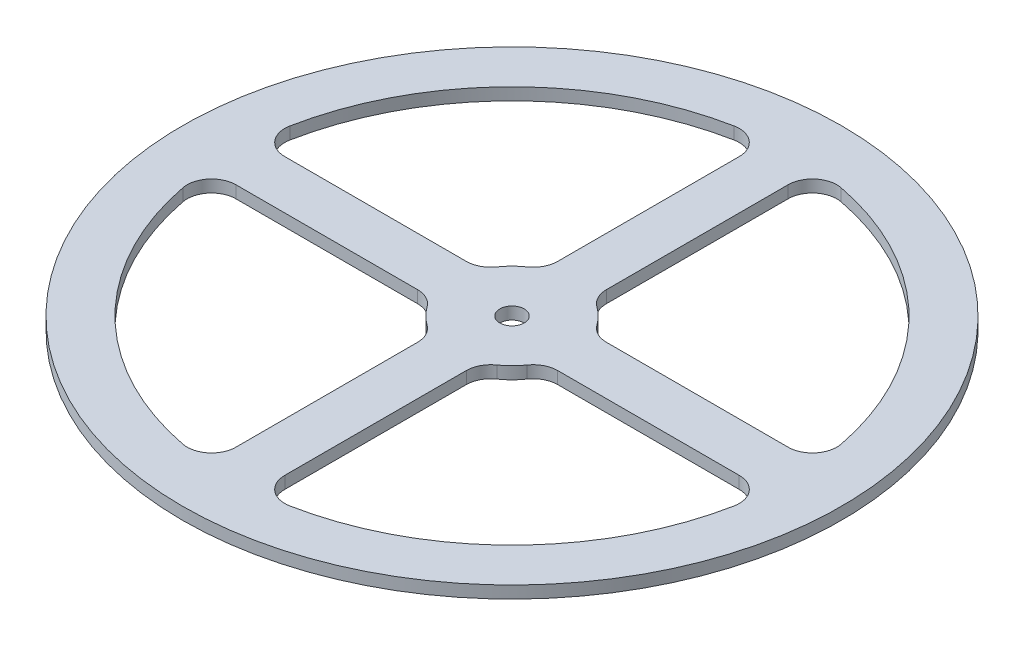
from build123d import *

# Parameters (mm, degrees)
SKETCH_1_R      = 135
SKETCH_1_R_2    = 5
EXTRUDE_1_DEPTH = 5


with BuildPart() as part:
    # ｽｹｯﾁ1 → ﾎﾞｽ - 押し出し1 (new body)
    with BuildSketch(Plane(origin=(0, 0, 0), x_dir=(1, 0, 0), z_dir=(0, 1, 0))):
        with Locations(Location((0, 0, 0), (0, 0, 270))):
            Circle(SKETCH_1_R)
        with Locations(Location((0, 0, 0), (0, 0, 270))):
            Circle(SKETCH_1_R_2, mode=Mode.SUBTRACT)
        with BuildLine():
            Line((-103.07764064, 10), (-28.722813233, 10))
            ThreePointArc((-28.722813233, 10), (-24.093712734, 11.135947396), (-20.516295166, 14.285714286))
            ThreePointArc((-20.516295166, 14.285714286), (-17.67766953, 17.67766953), (-14.285714286, 20.516295166))
            ThreePointArc((-14.285714286, 20.516295166), (-11.135947396, 24.093712734), (-10, 28.722813233))
            Line((-10, 28.722813233), (-10, 103.07764064))
            ThreePointArc((-10, 103.07764064), (-13.637909897, 110.792808139), (-21.904761905, 112.894558797))
            ThreePointArc((-21.904761905, 112.894558797), (-81.317279836, 81.317279836), (-112.894558797, 21.904761905))
            ThreePointArc((-112.894558797, 21.904761905), (-110.792808139, 13.637909897), (-103.07764064, 10))
        make_face(mode=Mode.SUBTRACT)
        with BuildLine():
            Line((10, 103.07764064), (10, 28.722813233))
            ThreePointArc((10, 28.722813233), (11.135947396, 24.093712734), (14.285714286, 20.516295166))
            ThreePointArc((14.285714286, 20.516295166), (17.67766953, 17.67766953), (20.516295166, 14.285714286))
            ThreePointArc((20.516295166, 14.285714286), (24.093712734, 11.135947396), (28.722813233, 10))
            Line((28.722813233, 10), (103.07764064, 10))
            ThreePointArc((103.07764064, 10), (110.792808139, 13.637909897), (112.894558797, 21.904761905))
            ThreePointArc((112.894558797, 21.904761905), (81.317279836, 81.317279836), (21.904761905, 112.894558797))
            ThreePointArc((21.904761905, 112.894558797), (13.637909897, 110.792808139), (10, 103.07764064))
        make_face(mode=Mode.SUBTRACT)
        with BuildLine():
            Line((103.07764064, -10), (28.722813233, -10))
            ThreePointArc((28.722813233, -10), (24.093712734, -11.135947396), (20.516295166, -14.285714286))
            ThreePointArc((20.516295166, -14.285714286), (17.67766953, -17.67766953), (14.285714286, -20.516295166))
            ThreePointArc((14.285714286, -20.516295166), (11.135947396, -24.093712734), (10, -28.722813233))
            Line((10, -28.722813233), (10, -103.07764064))
            ThreePointArc((10, -103.07764064), (13.637909897, -110.792808139), (21.904761905, -112.894558797))
            ThreePointArc((21.904761905, -112.894558797), (81.317279836, -81.317279836), (112.894558797, -21.904761905))
            ThreePointArc((112.894558797, -21.904761905), (110.792808139, -13.637909897), (103.07764064, -10))
        make_face(mode=Mode.SUBTRACT)
        with BuildLine():
            Line((-10, -103.07764064), (-10, -28.722813233))
            ThreePointArc((-10, -28.722813233), (-11.135947396, -24.093712734), (-14.285714286, -20.516295166))
            ThreePointArc((-14.285714286, -20.516295166), (-17.67766953, -17.67766953), (-20.516295166, -14.285714286))
            ThreePointArc((-20.516295166, -14.285714286), (-24.093712734, -11.135947396), (-28.722813233, -10))
            Line((-28.722813233, -10), (-103.07764064, -10))
            ThreePointArc((-103.07764064, -10), (-110.792808139, -13.637909897), (-112.894558797, -21.904761905))
            ThreePointArc((-112.894558797, -21.904761905), (-81.317279836, -81.317279836), (-21.904761905, -112.894558797))
            ThreePointArc((-21.904761905, -112.894558797), (-13.637909897, -110.792808139), (-10, -103.07764064))
        make_face(mode=Mode.SUBTRACT)
    extrude(amount=EXTRUDE_1_DEPTH)


solid = part.part
